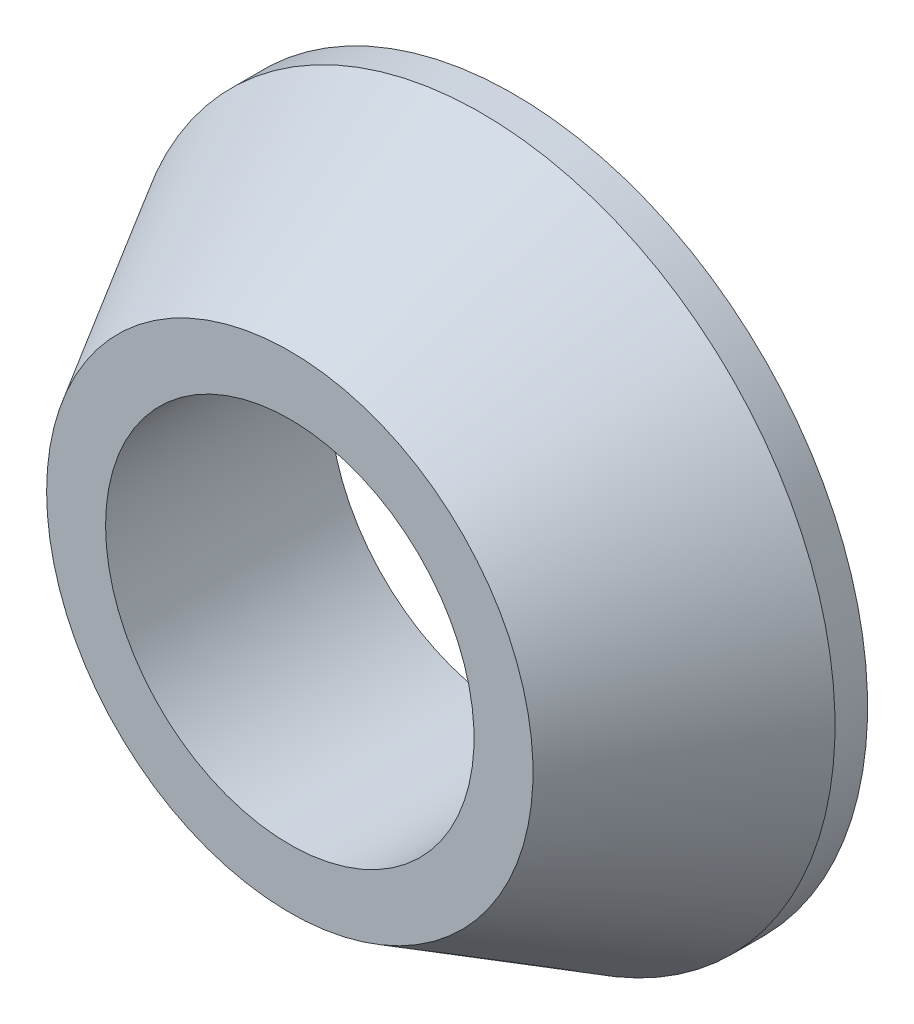
from build123d import *


with BuildPart() as part:
    # Sketch1 → Revolve1 (revolve)
    with BuildSketch(Plane.YZ, mode=Mode.PRIVATE) as revolve1_sk:
        Polygon((3.96875, 4.826), (3.96875, 0), (7.62, 0), (7.62, 0.701554014), (5.23875, 4.826), align=None)
    revolve(revolve1_sk.sketch.rotate(Axis((0, 0, 0), (0, 0, 1)), 90), axis=Axis((0, 0, 0), (0, 0, 1)))


solid = part.part
